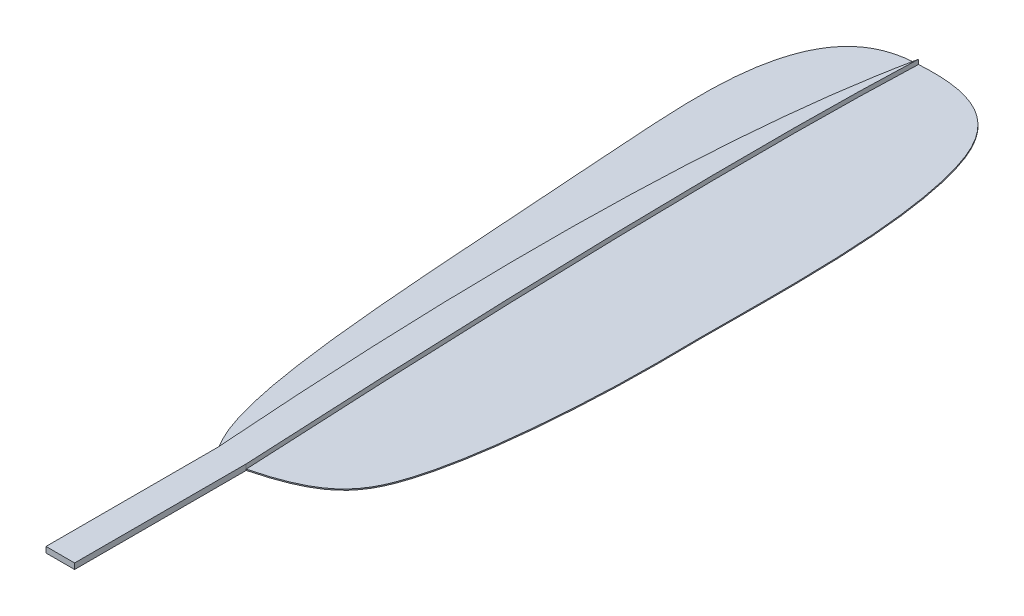
from build123d import *

# Parameters (mm, degrees)
BOSS_EXTRUDE1_DEPTH = 1
BOSS_EXTRUDE2_DEPTH = 0.2


with BuildPart() as part:
    # Sketch2 → Boss-Extrude1 (new body)
    with BuildSketch(Plane(origin=(0, 0, 0), x_dir=(1, 0, 0), z_dir=(0, 1, 0))):
        with BuildLine():
            add(Edge.make_bspline(
                [(-2.5, 0), (-8.331510312, 79.88522278), (0, 120)],
                knots=[0, 0, 0, 1, 1, 1], degree=2))
            Line((-2.5, 0), (-2.5, -30))
            Line((-2.5, -30), (2.5, -30))
            Line((2.5, -30), (2.5, 0))
            add(Edge.make_bspline(
                [(2.5, 0), (-1.639184348, 79.830180153), (0, 120)],
                knots=[0, 0, 0, 1, 1, 1], degree=2))
        make_face()
    extrude(amount=BOSS_EXTRUDE1_DEPTH)

    # Sketch2<4> → Boss-Extrude2 (add)
    with BuildSketch(Plane(origin=(0, 0, 0), x_dir=(1, 0, 0), z_dir=(0, 1, 0))):
        with BuildLine():
            add(Edge.make_bspline(
                [(0, 120), (-7.357536045, 119.756200735), (-16.129085045, 114.539529428), (-10.960373375, 43.623400867), (-9.557728223, 8.38325723), (-2.5, 0)],
                knots=[0, 0, 0, 0, 0.313531983, 0.413531983, 1, 1, 1, 1], degree=3))
            add(Edge.make_bspline(
                [(-2.5, 0), (-8.331510312, 79.88522278), (0, 120)],
                knots=[0, 0, 0, 1, 1, 1], degree=2))
        make_face()
        with BuildLine():
            add(Edge.make_bspline(
                [(2.5, 0), (12.93217727, 2.692777353), (20.627994331, 11.539628461), (22.537131076, 45.079701294), (22.031174233, 66.371038208), (23.143387213, 92.940026456), (16.08225383, 117.629559659), (8.942412889, 120.567138422), (0, 120)],
                knots=[0, 0, 0, 0, 0.15609962, 0.39468135, 0.460940872, 0.752435315, 0.809984908, 1, 1, 1, 1], degree=3))
            add(Edge.make_bspline(
                [(2.5, 0), (-1.639184348, 79.830180153), (0, 120)],
                knots=[0, 0, 0, 1, 1, 1], degree=2))
        make_face()
    extrude(amount=BOSS_EXTRUDE2_DEPTH)


solid = part.part
